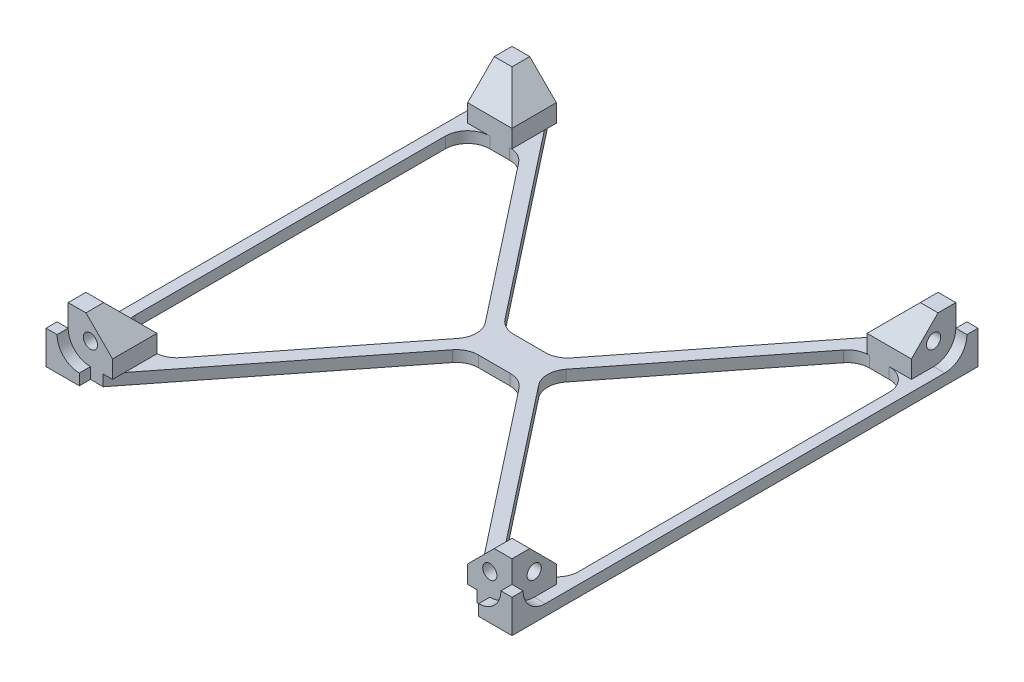
from build123d import *

# Parameters (mm, degrees)
SKETCH1_R                    = 1.625
BOSS_EXTRUDE1_DEPTH          = 2.5
FILLET1_R                    = 5
FILLET2_R                    = 5
CHAMFER2_SIZE                = 1.6
SKETCH2_W                    = 10
SKETCH2_H                    = 10
BOSS_EXTRUDE2_DEPTH          = 10
SKETCH3_R                    = 1.6
CUT_EXTRUDE1_DEPTH           = 3.2
SKETCH4_R                    = 1.6
CUT_EXTRUDE2_DEPTH           = 3.2
CHAMFER1_SIZE                = 6
BOSS_EXTRUDE3_DEPTH          = 5
CIRPATTERN1_COUNT            = 4
CHAMFER1_OF_CIRPATTERN1_SIZE = 6
SKETCH7_R                    = 5
CUT_EXTRUDE5_DEPTH           = 2.5
SKETCH6_R                    = 5
CUT_EXTRUDE6_DEPTH           = 2.5
CUT_EXTRUDE7_START           = -2.5
SKETCH8_R                    = 5
CUT_EXTRUDE7_DEPTH           = 2.5
CUT_EXTRUDE8_START           = -2.5
SKETCH9_R                    = 5
CUT_EXTRUDE8_DEPTH           = 2.5


with BuildPart() as part:
    # Sketch1 → Boss-Extrude1 (new body)
    with BuildSketch(Plane(origin=(0, 0, 0), x_dir=(1, 0, 0), z_dir=(0, 1, 0))):
        Polygon((-52.5, 45), (-52.5, -45), (-52.5, -52.5), (-45, -52.5), (-45, -50), (-42.127158908, -50), (-6, -4), (6, -4), (42.127158908, -50), (45, -50), (45, -52.5), (52.5, -52.5), (52.5, -45), (52.5, 45), (52.5, 52.5), (45, 52.5), (45, 50), (42.127158908, 50), (6, 4), (-6, 4), (-42.127158908, 50), (-45, 50), (-45, 52.5), (-52.5, 52.5), align=None)
        with Locations(Location((-45, 45, 0), (0, 0, 270))):
            Circle(SKETCH1_R, mode=Mode.SUBTRACT)
        with Locations(Location((45, 45, 0), (0, 0, 270))):
            Circle(SKETCH1_R, mode=Mode.SUBTRACT)
        with Locations(Location((45, -45, 0), (0, 0, 270))):
            Circle(SKETCH1_R, mode=Mode.SUBTRACT)
        with Locations(Location((-45, -45, 0), (0, 0, 270))):
            Circle(SKETCH1_R, mode=Mode.SUBTRACT)
        Polygon((-50, 40), (-50, -40), (-38.088044946, -40), (-6.673124156, 0), (-38.088044946, 40), align=None, mode=Mode.SUBTRACT)
        Polygon((50, -40), (38.088044946, -40), (6.673124156, 0), (38.088044946, 40), (50, 40), align=None, mode=Mode.SUBTRACT)
    extrude(amount=BOSS_EXTRUDE1_DEPTH)

    # Fillet1
    fillet1_edges = [part.edges().sort_by_distance(p)[0] for p in [
        (6, 1.25, 4),
        (-6, 1.25, 4),
        (-6, 1.25, -4),
        (6, 1.25, -4),
        (-6.673124156, 1.25, 0),
        (6.673124156, 1.25, 0),
    ]]
    fillet(fillet1_edges, radius=FILLET1_R)

    # Fillet2
    fillet2_edges = [part.edges().sort_by_distance(p)[0] for p in [
        (-38.088044946, 1.25, -40),
        (-50, 1.25, -40),
        (-50, 1.25, 40),
        (-38.088044946, 1.25, 40),
        (50, 1.25, 40),
        (50, 1.25, -40),
        (38.088044946, 1.25, -40),
        (38.088044946, 1.25, 40),
    ]]
    fillet(fillet2_edges, radius=FILLET2_R)

    # Chamfer2
    chamfer2_edges = [part.edges().sort_by_distance(p)[0] for p in [
        (-45, 0, -46.625),
        (45, 0, -46.625),
        (45, 0, 43.375),
        (-45, 0, 43.375),
    ]]
    chamfer(chamfer2_edges, length=CHAMFER2_SIZE)

    # Sketch2 → Boss-Extrude2 (add)
    with BuildSketch(Plane(origin=(0, 2.5, 0), x_dir=(1, 0, 0), z_dir=(0, 1, 0))):
        with Locations((-45, 45)):
            Rectangle(SKETCH2_W, SKETCH2_H)
    boss_extrude2 = extrude(amount=BOSS_EXTRUDE2_DEPTH)

    # Sketch3 → Cut-Extrude1 (cut)
    with BuildSketch(Plane.ZY.offset(50)):
        with Locations((-45, 7.5)):
            Circle(SKETCH3_R)
    cut_extrude1 = extrude(amount=-CUT_EXTRUDE1_DEPTH, mode=Mode.SUBTRACT)

    # Sketch4 → Cut-Extrude2 (cut)
    with BuildSketch(Plane(origin=(0, 0, -50), x_dir=(-1, 0, 0), z_dir=(0, 0, -1))):
        with Locations((45, 7.5)):
            Circle(SKETCH4_R)
    cut_extrude2 = extrude(amount=-CUT_EXTRUDE2_DEPTH, mode=Mode.SUBTRACT)

    # Chamfer1
    chamfer1_edges = [part.edges().sort_by_distance(p)[0] for p in [
        (-40, 12.5, -45),
        (-45, 12.5, -40),
    ]]
    chamfer(chamfer1_edges, length=CHAMFER1_SIZE)

    # Sketch5 → Boss-Extrude3 (add)
    with BuildSketch(Plane(origin=(0, 2.5, 0), x_dir=(1, 0, 0), z_dir=(0, 1, 0))):
        Polygon((-45, 50), (-45, 52.5), (-52.5, 52.5), (-52.5, 45), (-50, 45), (-50, 50), align=None)
    boss_extrude3 = extrude(amount=BOSS_EXTRUDE3_DEPTH)

    # CirPattern1: Boss-Extrude2, Cut-Extrude1, Cut-Extrude2, Boss-Extrude3 ×4 about axis
    cirpattern1_axis = Axis((0, 0, 0), (0, 1, 0))
    add([boss_extrude2.rotate(cirpattern1_axis, i * 360 / CIRPATTERN1_COUNT) for i in range(1, CIRPATTERN1_COUNT)])
    add([cut_extrude1.rotate(cirpattern1_axis, i * 360 / CIRPATTERN1_COUNT) for i in range(1, CIRPATTERN1_COUNT)], mode=Mode.SUBTRACT)
    add([cut_extrude2.rotate(cirpattern1_axis, i * 360 / CIRPATTERN1_COUNT) for i in range(1, CIRPATTERN1_COUNT)], mode=Mode.SUBTRACT)
    add([boss_extrude3.rotate(cirpattern1_axis, i * 360 / CIRPATTERN1_COUNT) for i in range(1, CIRPATTERN1_COUNT)])

    # Chamfer1 of CirPattern1
    chamfer1_of_cirpattern1_edges = [part.edges().sort_by_distance(p)[0] for p in [
        (-45, 12.5, 40),
        (-40, 12.5, 45),
        (40, 12.5, 45),
        (45, 12.5, 40),
        (45, 12.5, -40),
        (40, 12.5, -45),
    ]]
    chamfer(chamfer1_of_cirpattern1_edges, length=CHAMFER1_OF_CIRPATTERN1_SIZE)

    # Sketch7 → Cut-Extrude5 (cut)
    with BuildSketch(Plane(origin=(0, 0, -52.5), x_dir=(-1, 0, 0), z_dir=(0, 0, -1))):
        with Locations((45, 7.5)):
            Circle(SKETCH7_R)
        with Locations((-45, 7.5)):
            Circle(SKETCH7_R)
    extrude(amount=-CUT_EXTRUDE5_DEPTH, mode=Mode.SUBTRACT)

    # Sketch6 → Cut-Extrude6 (cut)
    with BuildSketch(Plane.ZY.offset(52.5)):
        with Locations((-45, 7.5)):
            Circle(SKETCH6_R)
        with Locations((45, 7.5)):
            Circle(SKETCH6_R)
    extrude(amount=-CUT_EXTRUDE6_DEPTH, mode=Mode.SUBTRACT)

    # Sketch8 → Cut-Extrude7 (cut)
    with BuildSketch(Plane.XY.offset(52.5).offset(CUT_EXTRUDE7_START)):
        with Locations((-45, 7.5)):
            Circle(SKETCH8_R)
        with Locations((45, 7.5)):
            Circle(SKETCH8_R)
    extrude(amount=CUT_EXTRUDE7_DEPTH, mode=Mode.SUBTRACT)

    # Sketch9 → Cut-Extrude8 (cut)
    with BuildSketch(Plane(origin=(52.5, 0, 0), x_dir=(0, 0, -1), z_dir=(1, 0, 0)).offset(CUT_EXTRUDE8_START)):
        with Locations((-45, 7.5)):
            Circle(SKETCH9_R)
        with Locations((45, 7.5)):
            Circle(SKETCH9_R)
    extrude(amount=CUT_EXTRUDE8_DEPTH, mode=Mode.SUBTRACT)


solid = part.part
